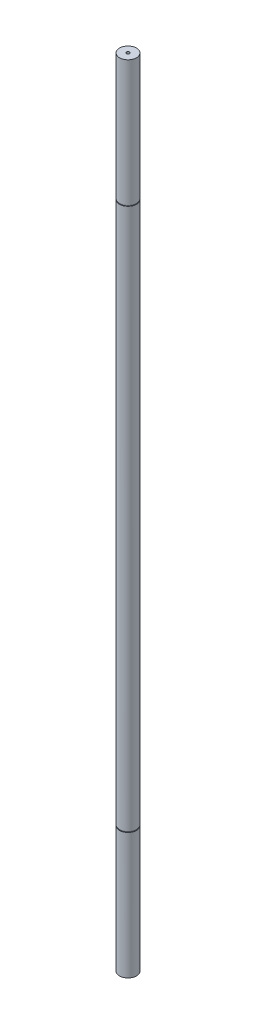
from build123d import *

# Parameters (mm, degrees)
SKETCH1_R           = 6.35
BOSS_EXTRUDE1_DEPTH = 596.9
SKETCH2_R           = 1.190625
CUT_EXTRUDE1_DEPTH  = 609.6
SKETCH6_OUTSIDE_W   = 134.134
SKETCH6_OUTSIDE_H   = 134.134
SKETCH6_OUTSIDE_R   = 5.9563
CUT_EXTRUDE2_DEPTH  = 0.635


with BuildPart() as part:
    # Sketch1 → Boss-Extrude1 (new body)
    with BuildSketch(Plane(origin=(0, 0, 0), x_dir=(1, 0, 0), z_dir=(0, 1, 0))):
        with Locations(Location((0, 0, 0), (0, 0, 270))):
            Circle(SKETCH1_R)
    extrude(amount=BOSS_EXTRUDE1_DEPTH)

    # Sketch2 → Cut-Extrude1 (cut)
    with BuildSketch(Plane(origin=(0, 596.9, 0), x_dir=(1, 0, 0), z_dir=(0, 1, 0))):
        with Locations(Location((0, 0, 0), (0, 0, 270))):
            Circle(SKETCH2_R)
    extrude(amount=-CUT_EXTRUDE1_DEPTH, mode=Mode.SUBTRACT)

    # Sketch6 outside → Cut-Extrude2 (cut)
    with BuildSketch(Plane(origin=(0, 95.25, 0), x_dir=(-1, 0, 0), z_dir=(0, -1, 0))):
        Rectangle(SKETCH6_OUTSIDE_W, SKETCH6_OUTSIDE_H)
        with Locations(Location((0, 0, 0), (0, 0, 90))):
            Circle(SKETCH6_OUTSIDE_R, mode=Mode.SUBTRACT)
    cut_extrude2 = extrude(amount=CUT_EXTRUDE2_DEPTH, mode=Mode.SUBTRACT)

    # Mirror1: Cut-Extrude2 across plane
    add(cut_extrude2.mirror(Plane(origin=(0, 298.45, 0), x_dir=(0, 0, 1), z_dir=(0, -1, 0))), mode=Mode.SUBTRACT)


solid = part.part
